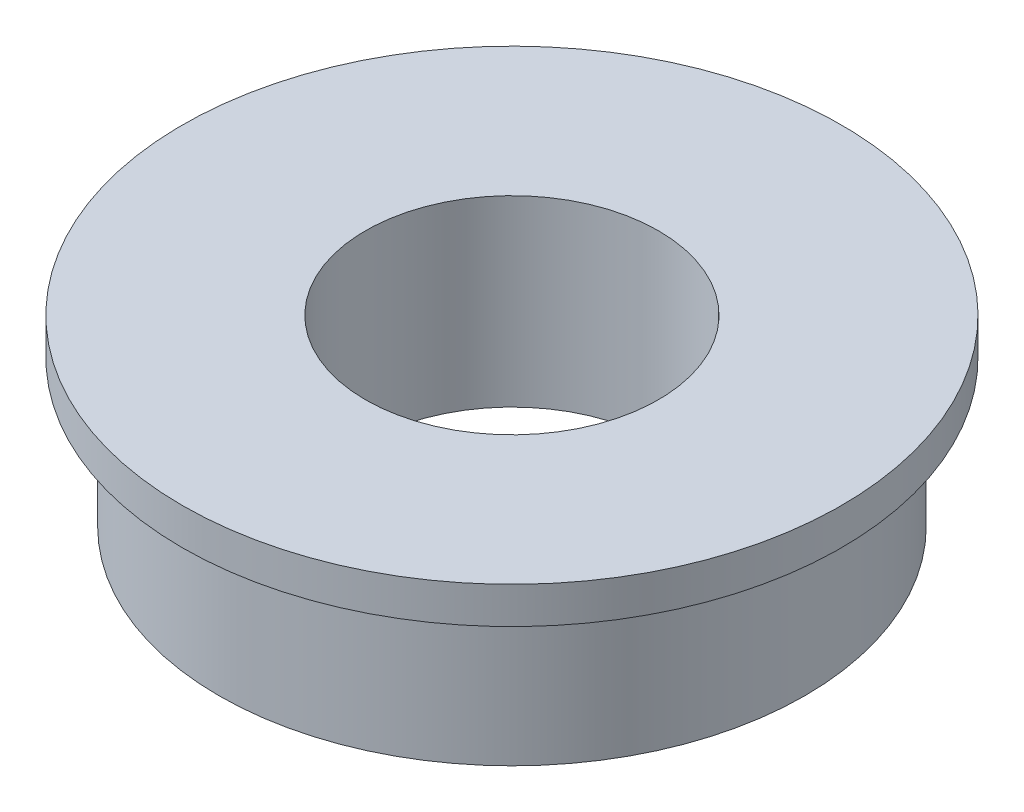
from build123d import *

# Parameters (mm, degrees)
SKETCH1_R           = 8
SKETCH1_R_2         = 4
BOSS_EXTRUDE1_DEPTH = 4
SKETCH2_R           = 9
SKETCH2_R_2         = 4
BOSS_EXTRUDE2_DEPTH = 1


with BuildPart() as part:
    # Sketch1 → Boss-Extrude1 (new body)
    with BuildSketch(Plane(origin=(0, 0, 0), x_dir=(1, 0, 0), z_dir=(0, 1, 0))):
        with Locations(Location((0, 0, 0), (0, 0, 270))):
            Circle(SKETCH1_R)
        with Locations(Location((0, 0, 0), (0, 0, 270))):
            Circle(SKETCH1_R_2, mode=Mode.SUBTRACT)
    extrude(amount=BOSS_EXTRUDE1_DEPTH)

    # Sketch2 → Boss-Extrude2 (add)
    with BuildSketch(Plane(origin=(0, 4, 0), x_dir=(1, 0, 0), z_dir=(0, 1, 0))):
        with Locations(Location((0, 0, 0), (0, 0, 270))):
            Circle(SKETCH2_R)
        with Locations(Location((0, 0, 0), (0, 0, 270))):
            Circle(SKETCH2_R_2, mode=Mode.SUBTRACT)
    extrude(amount=BOSS_EXTRUDE2_DEPTH)


solid = part.part
